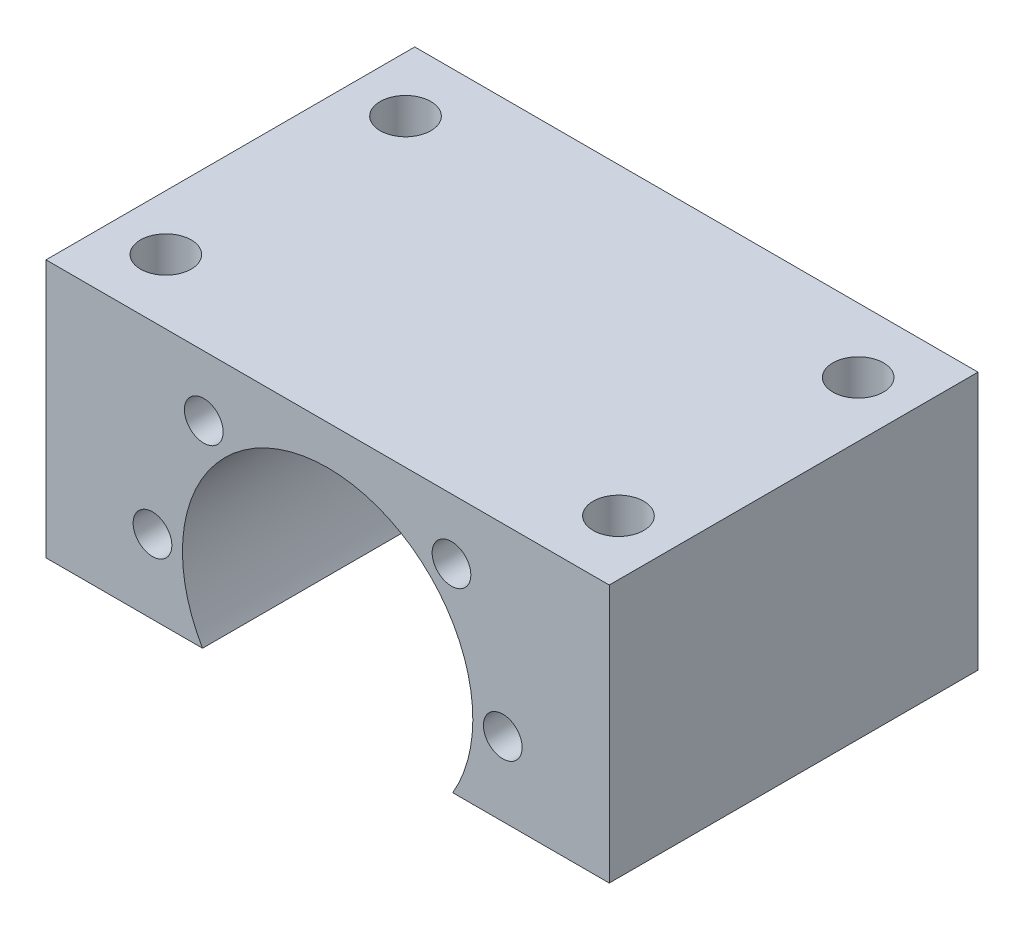
from build123d import *

# Parameters (mm, degrees)
SKETCH1_R           = 2.1
BOSS_EXTRUDE1_DEPTH = 40
SKETCH2_R           = 2.75
CUT_EXTRUDE1_DEPTH  = 50


with BuildPart() as part:
    # Sketch1 → Boss-Extrude1 (new body)
    with BuildSketch(Plane.XY):
        with BuildLine():
            Line((13.266499161, 40), (-13.266499161, 40))
            Line((-13.266499161, 40), (-27.55, 40))
            Line((-27.55, 40), (-30.55, 40))
            Line((-30.55, 40), (-30.55, 12))
            Line((-30.55, 12), (-27.55, 12))
            Line((-27.55, 12), (-13.566963551, 12))
            ThreePointArc((-13.566963551, 12), (0, 35.75), (13.566963551, 12))
            Line((13.566963551, 12), (27.55, 12))
            Line((27.55, 12), (30.55, 12))
            Line((30.55, 12), (30.55, 40))
            Line((30.55, 40), (27.55, 40))
            Line((27.55, 40), (13.266499161, 40))
        make_face()
        with Locations((-13.435028843, 33.435028843)):
            Circle(SKETCH1_R, mode=Mode.SUBTRACT)
        with Locations((19, 20)):
            Circle(SKETCH1_R, mode=Mode.SUBTRACT)
        with Locations((13.435028843, 33.435028843)):
            Circle(SKETCH1_R, mode=Mode.SUBTRACT)
        with Locations((-19, 20)):
            Circle(SKETCH1_R, mode=Mode.SUBTRACT)
    extrude(amount=-BOSS_EXTRUDE1_DEPTH)

    # Sketch2 → Cut-Extrude1 (cut)
    with BuildSketch(Plane(origin=(0, 40, 0), x_dir=(1, 0, 0), z_dir=(0, 1, 0))):
        with Locations(Location((-24.55, 33, 0), (0, 0, 270))):
            Circle(SKETCH2_R)
        with Locations(Location((-24.55, 7, 0), (0, 0, 270))):
            Circle(SKETCH2_R)
        with Locations(Location((24.55, 7, 0), (0, 0, 270))):
            Circle(SKETCH2_R)
        with Locations(Location((24.55, 33, 0), (0, 0, 270))):
            Circle(SKETCH2_R)
    extrude(amount=-CUT_EXTRUDE1_DEPTH, mode=Mode.SUBTRACT)


solid = part.part
